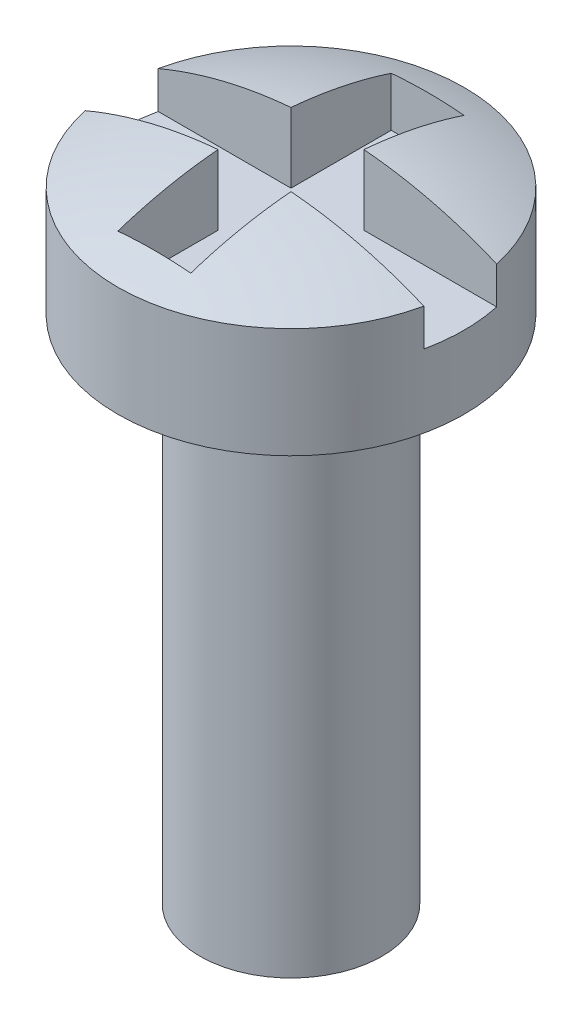
from build123d import *

# Parameters (mm, degrees)
SKETCH_1_R          = 1.25
EXTRUDE_1_DEPTH     = 7
SKETCH_2_R          = 2.375
EXTRUDE_2_DEPTH     = 2
SKETCH_3_W          = 7.004697232
SKETCH_3_H          = 1
CUT_EXTRUDE_1_DEPTH = 1
SKETCH_4_W          = 1
SKETCH_4_H          = 3.75
CUT_EXTRUDE_2_DEPTH = 1


with BuildPart() as part:
    # 草图1 → 拉伸1 (new body)
    with BuildSketch(Plane(origin=(0, 0, 0), x_dir=(1, 0, 0), z_dir=(0, 1, 0))):
        with Locations(Location((0, 0, 0), (0, 0, 270))):
            Circle(SKETCH_1_R)
    extrude(amount=EXTRUDE_1_DEPTH)

    # 草图2 → 拉伸2 (add)
    with BuildSketch(Plane(origin=(0, 7, 0), x_dir=(-1, 0, 0), z_dir=(0, 1, 0))):
        with Locations(Location((0, 0, 0), (0, 0, 90))):
            Circle(SKETCH_2_R)
    extrude(amount=EXTRUDE_2_DEPTH)

    # 草图3 → 切除-拉伸1 (cut)
    with BuildSketch(Plane(origin=(0, 9, 0), x_dir=(-1, 0, 0), z_dir=(0, 1, 0))):
        Rectangle(SKETCH_3_W, SKETCH_3_H)
    extrude(amount=-CUT_EXTRUDE_1_DEPTH, mode=Mode.SUBTRACT)

    # 草图4 → 切除-拉伸2 (cut)
    with BuildSketch(Plane(origin=(0, 9, 0), x_dir=(-1, 0, 0), z_dir=(0, 1, 0))):
        Rectangle(SKETCH_4_W, SKETCH_4_H)
    extrude(amount=-CUT_EXTRUDE_2_DEPTH, mode=Mode.SUBTRACT)

    # 草图5 → 切除-旋转16 (revolve, cut)
    with BuildSketch(Plane(origin=(0, 0, 0), x_dir=(0, 0, -1), z_dir=(1, 0, 0)), mode=Mode.PRIVATE) as cut_revolve_16_sk:
        with BuildLine():
            Line((0, 10.999822694), (-4.5493707, 10.999822694))
            Line((-4.5493707, 10.999822694), (-4.5493707, 6.911933822))
            ThreePointArc((-4.5493707, 6.911933822), (-2.502838096, 8.453054325), (0, 9))
            Line((0, 9), (0, 10.999822694))
        make_face()
    revolve(cut_revolve_16_sk.sketch.rotate(Axis((0, -2.105917543, 0), (0, 1, 0)), 257.846802531), axis=Axis((0, -2.105917543, 0), (0, 1, 0)), mode=Mode.SUBTRACT)


solid = part.part
